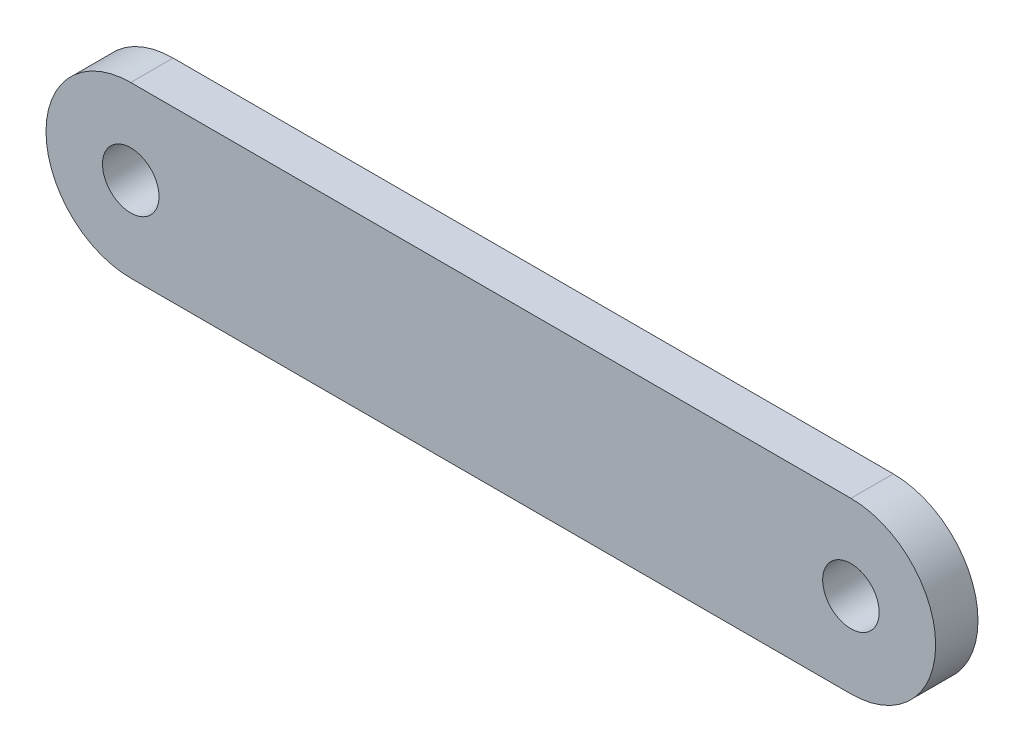
from build123d import *

# Parameters (mm, degrees)
ESQUISSE1_R      = 1
EXTRUSION1_DEPTH = 1.5


with BuildPart() as part:
    # Esquisse1 → Extrusion1 (new body)
    with BuildSketch(Plane.XY):
        with BuildLine():
            Line((-25.5, 3), (0, 3))
            ThreePointArc((0, 3), (3, 0), (0, -3))
            Line((0, -3), (-25.5, -3))
            ThreePointArc((-25.5, -3), (-28.5, 0), (-25.5, 3))
        make_face()
        Circle(ESQUISSE1_R, mode=Mode.SUBTRACT)
        with Locations((-25.5, 0)):
            Circle(ESQUISSE1_R, mode=Mode.SUBTRACT)
    extrude(amount=-EXTRUSION1_DEPTH)


solid = part.part
